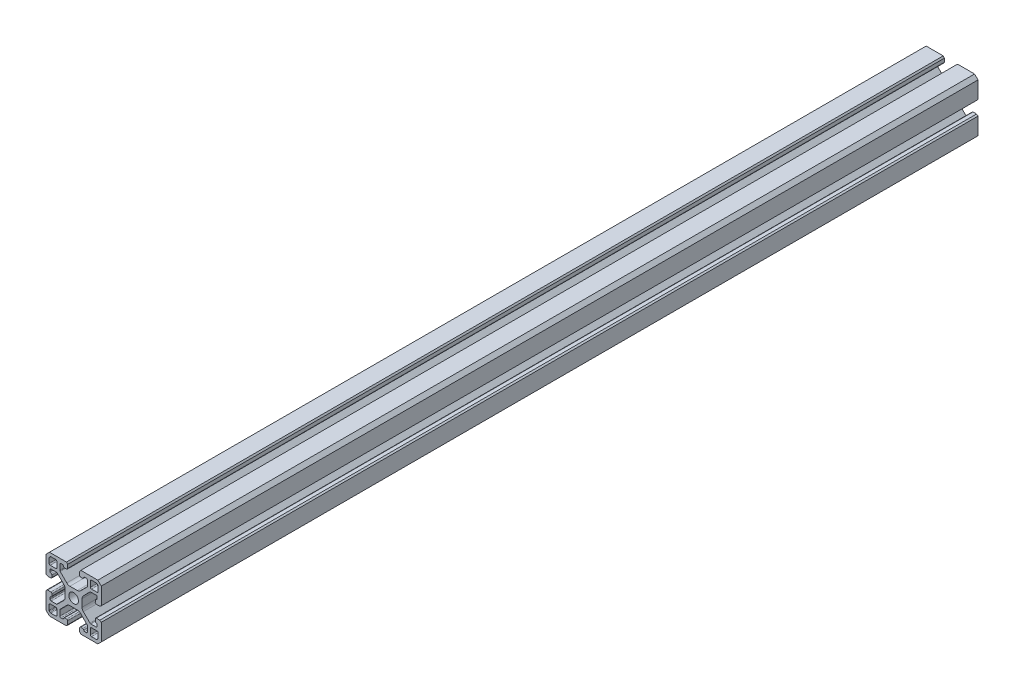
from build123d import *

# Parameters (mm, degrees)
SKETCH1_R           = 3.3147
BOSS_EXTRUDE1_DEPTH = 604.52


with BuildPart() as part:
    # Sketch1 → Boss-Extrude1 (new body)
    with BuildSketch(Plane(origin=(0, 0, 0), x_dir=(-1, 0, 0), z_dir=(0, 0, 1))):
        with BuildLine():
            Line((-19.05, 4.9276), (-19.05, 16.6878))
            Line((-19.05, 16.6878), (-16.6878, 19.05))
            Line((-16.6878, 19.05), (-4.9276, 19.05))
            Line((-4.9276, 19.05), (-4.1656, 18.044024186))
            Line((-4.1656, 18.044024186), (-4.1656, 15.669241304))
            ThreePointArc((-4.1656, 15.669241304), (-4.393507141, 15.125744462), (-4.940898734, 14.90735736))
            Line((-4.940898734, 14.90735736), (-6.223767748, 14.929749922))
            ThreePointArc((-6.223767748, 14.929749922), (-6.718113097, 15.123354458), (-6.966034507, 15.592816933))
            ThreePointArc((-6.966034507, 15.592816933), (-7.218934357, 16.066687743), (-7.7216, 16.256))
            Line((-7.7216, 16.256), (-8.763, 16.256))
            ThreePointArc((-8.763, 16.256), (-9.301815367, 16.032815367), (-9.525, 15.494))
            Line((-9.525, 15.494), (-9.525, 11.816287081))
            ThreePointArc((-9.525, 11.816287081), (-9.466996204, 11.524682306), (-9.301815367, 11.277471714))
            Line((-9.301815367, 11.277471714), (-4.7244731, 6.700129446))
            ThreePointArc((-4.7244731, 6.700129446), (-3.735630732, 6.0394061), (-2.569211631, 5.807390915))
            Line((-2.569211631, 5.807390915), (2.569211631, 5.807390915))
            ThreePointArc((2.569211631, 5.807390915), (3.735630732, 6.0394061), (4.7244731, 6.700129446))
            Line((4.7244731, 6.700129446), (9.301815367, 11.277471714))
            ThreePointArc((9.301815367, 11.277471714), (9.466996204, 11.524682306), (9.525, 11.816287081))
            Line((9.525, 11.816287081), (9.525, 15.494))
            ThreePointArc((9.525, 15.494), (9.301815367, 16.032815367), (8.763, 16.256))
            Line((8.763, 16.256), (7.7216, 16.256))
            ThreePointArc((7.7216, 16.256), (7.218934357, 16.066687743), (6.966034507, 15.592816933))
            ThreePointArc((6.966034507, 15.592816933), (6.718113097, 15.123354458), (6.223767748, 14.929749922))
            Line((6.223767748, 14.929749922), (4.940898734, 14.90735736))
            ThreePointArc((4.940898734, 14.90735736), (4.393507141, 15.125744462), (4.1656, 15.669241304))
            Line((4.1656, 15.669241304), (4.1656, 18.044024186))
            Line((4.1656, 18.044024186), (4.9276, 19.05))
            Line((4.9276, 19.05), (16.6878, 19.05))
            Line((16.6878, 19.05), (19.05, 16.6878))
            Line((19.05, 16.6878), (19.05, 4.9276))
            Line((19.05, 4.9276), (18.044024186, 4.1656))
            Line((18.044024186, 4.1656), (15.669241304, 4.1656))
            ThreePointArc((15.669241304, 4.1656), (15.125744462, 4.393507141), (14.90735736, 4.940898734))
            Line((14.90735736, 4.940898734), (14.929749922, 6.223767748))
            ThreePointArc((14.929749922, 6.223767748), (15.123354458, 6.718113097), (15.592816933, 6.966034507))
            ThreePointArc((15.592816933, 6.966034507), (16.066687743, 7.218934357), (16.256, 7.7216))
            Line((16.256, 7.7216), (16.256, 8.763))
            ThreePointArc((16.256, 8.763), (16.032815367, 9.301815367), (15.494, 9.525))
            Line((15.494, 9.525), (11.816287081, 9.525))
            ThreePointArc((11.816287081, 9.525), (11.524682306, 9.466996204), (11.277471714, 9.301815367))
            Line((11.277471714, 9.301815367), (6.700129446, 4.7244731))
            ThreePointArc((6.700129446, 4.7244731), (6.0394061, 3.735630732), (5.807390915, 2.569211631))
            Line((5.807390915, 2.569211631), (5.807390915, -2.569211631))
            ThreePointArc((5.807390915, -2.569211631), (6.0394061, -3.735630732), (6.700129446, -4.7244731))
            Line((6.700129446, -4.7244731), (11.277471714, -9.301815367))
            ThreePointArc((11.277471714, -9.301815367), (11.524682306, -9.466996204), (11.816287081, -9.525))
            Line((11.816287081, -9.525), (15.494, -9.525))
            ThreePointArc((15.494, -9.525), (16.032815367, -9.301815367), (16.256, -8.763))
            Line((16.256, -8.763), (16.256, -7.7216))
            ThreePointArc((16.256, -7.7216), (16.066687743, -7.218934357), (15.592816933, -6.966034507))
            ThreePointArc((15.592816933, -6.966034507), (15.123354458, -6.718113097), (14.929749922, -6.223767748))
            Line((14.929749922, -6.223767748), (14.90735736, -4.940898734))
            ThreePointArc((14.90735736, -4.940898734), (15.125744462, -4.393507141), (15.669241304, -4.1656))
            Line((15.669241304, -4.1656), (18.044024186, -4.1656))
            Line((18.044024186, -4.1656), (19.05, -4.9276))
            Line((19.05, -4.9276), (19.05, -16.6878))
            Line((19.05, -16.6878), (16.6878, -19.05))
            Line((16.6878, -19.05), (4.940898734, -19.05))
            Line((4.940898734, -19.05), (4.1656, -18.044024186))
            Line((4.1656, -18.044024186), (4.1656, -15.669241304))
            ThreePointArc((4.1656, -15.669241304), (4.393507141, -15.125744462), (4.940898734, -14.90735736))
            Line((4.940898734, -14.90735736), (6.223767748, -14.929749922))
            ThreePointArc((6.223767748, -14.929749922), (6.718113097, -15.123354458), (6.966034507, -15.592816933))
            ThreePointArc((6.966034507, -15.592816933), (7.218934357, -16.066687743), (7.7216, -16.256))
            Line((7.7216, -16.256), (8.763, -16.256))
            ThreePointArc((8.763, -16.256), (9.301815367, -16.032815367), (9.525, -15.494))
            Line((9.525, -15.494), (9.525, -11.816287081))
            ThreePointArc((9.525, -11.816287081), (9.466996204, -11.524682306), (9.301815367, -11.277471714))
            Line((9.301815367, -11.277471714), (4.7244731, -6.700129446))
            ThreePointArc((4.7244731, -6.700129446), (3.735630732, -6.0394061), (2.569211631, -5.807390915))
            Line((2.569211631, -5.807390915), (-2.569211631, -5.807390915))
            ThreePointArc((-2.569211631, -5.807390915), (-3.735630732, -6.0394061), (-4.7244731, -6.700129446))
            Line((-4.7244731, -6.700129446), (-9.301815367, -11.277471714))
            ThreePointArc((-9.301815367, -11.277471714), (-9.466996204, -11.524682306), (-9.525, -11.816287081))
            Line((-9.525, -11.816287081), (-9.525, -15.494))
            ThreePointArc((-9.525, -15.494), (-9.301815367, -16.032815367), (-8.763, -16.256))
            Line((-8.763, -16.256), (-7.7216, -16.256))
            ThreePointArc((-7.7216, -16.256), (-7.218934357, -16.066687743), (-6.966034507, -15.592816933))
            ThreePointArc((-6.966034507, -15.592816933), (-6.718113097, -15.123354458), (-6.223767748, -14.929749922))
            Line((-6.223767748, -14.929749922), (-4.940898734, -14.90735736))
            ThreePointArc((-4.940898734, -14.90735736), (-4.393507141, -15.125744462), (-4.1656, -15.669241304))
            Line((-4.1656, -15.669241304), (-4.1656, -18.044024186))
            Line((-4.1656, -18.044024186), (-4.9276, -19.05))
            Line((-4.9276, -19.05), (-16.6878, -19.05))
            Line((-16.6878, -19.05), (-19.05, -16.6878))
            Line((-19.05, -16.6878), (-19.05, -4.9276))
            Line((-19.05, -4.9276), (-18.044024186, -4.1656))
            Line((-18.044024186, -4.1656), (-15.669241304, -4.1656))
            ThreePointArc((-15.669241304, -4.1656), (-15.125744462, -4.393507141), (-14.90735736, -4.940898734))
            Line((-14.90735736, -4.940898734), (-14.929749922, -6.223767748))
            ThreePointArc((-14.929749922, -6.223767748), (-15.123354458, -6.718113097), (-15.592816933, -6.966034507))
            ThreePointArc((-15.592816933, -6.966034507), (-16.066687743, -7.218934357), (-16.256, -7.7216))
            Line((-16.256, -7.7216), (-16.256, -8.763))
            ThreePointArc((-16.256, -8.763), (-16.032815367, -9.301815367), (-15.494, -9.525))
            Line((-15.494, -9.525), (-11.816287081, -9.525))
            ThreePointArc((-11.816287081, -9.525), (-11.524682306, -9.466996204), (-11.277471714, -9.301815367))
            Line((-11.277471714, -9.301815367), (-6.700129446, -4.7244731))
            ThreePointArc((-6.700129446, -4.7244731), (-6.0394061, -3.735630732), (-5.807390915, -2.569211631))
            Line((-5.807390915, -2.569211631), (-5.807390915, 2.569211631))
            ThreePointArc((-5.807390915, 2.569211631), (-6.0394061, 3.735630732), (-6.700129446, 4.7244731))
            Line((-6.700129446, 4.7244731), (-11.277471714, 9.301815367))
            ThreePointArc((-11.277471714, 9.301815367), (-11.524682306, 9.466996204), (-11.816287081, 9.525))
            Line((-11.816287081, 9.525), (-15.494, 9.525))
            ThreePointArc((-15.494, 9.525), (-16.032815367, 9.301815367), (-16.256, 8.763))
            Line((-16.256, 8.763), (-16.256, 7.7216))
            ThreePointArc((-16.256, 7.7216), (-16.066687743, 7.218934357), (-15.592816933, 6.966034507))
            ThreePointArc((-15.592816933, 6.966034507), (-15.123354458, 6.718113097), (-14.929749922, 6.223767748))
            Line((-14.929749922, 6.223767748), (-14.90735736, 4.940898734))
            ThreePointArc((-14.90735736, 4.940898734), (-15.125744462, 4.393507141), (-15.669241304, 4.1656))
            Line((-15.669241304, 4.1656), (-18.044024186, 4.1656))
            Line((-18.044024186, 4.1656), (-19.05, 4.9276))
        make_face()
        with Locations(Location((0, 0, 0), (0, 0, 180))):
            Circle(SKETCH1_R, mode=Mode.SUBTRACT)
        with BuildLine():
            Line((-16.8656, 12.319), (-16.8656, 15.682887307))
            ThreePointArc((-16.8656, 15.682887307), (-16.807596204, 15.974492082), (-16.642415367, 16.221702674))
            Line((-16.642415367, 16.221702674), (-16.221702674, 16.642415367))
            ThreePointArc((-16.221702674, 16.642415367), (-15.974492082, 16.807596204), (-15.682887307, 16.8656))
            Line((-15.682887307, 16.8656), (-12.319, 16.8656))
            ThreePointArc((-12.319, 16.8656), (-11.780184633, 16.642415367), (-11.557, 16.1036))
            Line((-11.557, 16.1036), (-11.557, 12.319))
            ThreePointArc((-11.557, 12.319), (-11.780184633, 11.780184633), (-12.319, 11.557))
            Line((-12.319, 11.557), (-16.1036, 11.557))
            ThreePointArc((-16.1036, 11.557), (-16.642415367, 11.780184633), (-16.8656, 12.319))
        make_face(mode=Mode.SUBTRACT)
        with BuildLine():
            Line((-16.1036, -11.557), (-12.319, -11.557))
            ThreePointArc((-12.319, -11.557), (-11.780184633, -11.780184633), (-11.557, -12.319))
            Line((-11.557, -12.319), (-11.557, -16.1036))
            ThreePointArc((-11.557, -16.1036), (-11.780184633, -16.642415367), (-12.319, -16.8656))
            Line((-12.319, -16.8656), (-15.682887307, -16.8656))
            ThreePointArc((-15.682887307, -16.8656), (-15.974492082, -16.807596204), (-16.221702674, -16.642415367))
            Line((-16.221702674, -16.642415367), (-16.642415367, -16.221702674))
            ThreePointArc((-16.642415367, -16.221702674), (-16.807596204, -15.974492082), (-16.8656, -15.682887307))
            Line((-16.8656, -15.682887307), (-16.8656, -12.319))
            ThreePointArc((-16.8656, -12.319), (-16.642415367, -11.780184633), (-16.1036, -11.557))
        make_face(mode=Mode.SUBTRACT)
        with BuildLine():
            Line((15.682887307, -16.8656), (12.319, -16.8656))
            ThreePointArc((12.319, -16.8656), (11.780184633, -16.642415367), (11.557, -16.1036))
            Line((11.557, -16.1036), (11.557, -12.319))
            ThreePointArc((11.557, -12.319), (11.780184633, -11.780184633), (12.319, -11.557))
            Line((12.319, -11.557), (16.1036, -11.557))
            ThreePointArc((16.1036, -11.557), (16.642415367, -11.780184633), (16.8656, -12.319))
            Line((16.8656, -12.319), (16.8656, -15.682887307))
            ThreePointArc((16.8656, -15.682887307), (16.807596204, -15.974492082), (16.642415367, -16.221702674))
            Line((16.642415367, -16.221702674), (16.221702674, -16.642415367))
            ThreePointArc((16.221702674, -16.642415367), (15.974492082, -16.807596204), (15.682887307, -16.8656))
        make_face(mode=Mode.SUBTRACT)
        with BuildLine():
            Line((11.557, 12.319), (11.557, 16.1036))
            ThreePointArc((11.557, 16.1036), (11.780184633, 16.642415367), (12.319, 16.8656))
            Line((12.319, 16.8656), (15.682887307, 16.8656))
            ThreePointArc((15.682887307, 16.8656), (15.974492082, 16.807596204), (16.221702674, 16.642415367))
            Line((16.221702674, 16.642415367), (16.642415367, 16.221702674))
            ThreePointArc((16.642415367, 16.221702674), (16.807596204, 15.974492082), (16.8656, 15.682887307))
            Line((16.8656, 15.682887307), (16.8656, 12.319))
            ThreePointArc((16.8656, 12.319), (16.642415367, 11.780184633), (16.1036, 11.557))
            Line((16.1036, 11.557), (12.319, 11.557))
            ThreePointArc((12.319, 11.557), (11.780184633, 11.780184633), (11.557, 12.319))
        make_face(mode=Mode.SUBTRACT)
    extrude(amount=BOSS_EXTRUDE1_DEPTH)


solid = part.part
